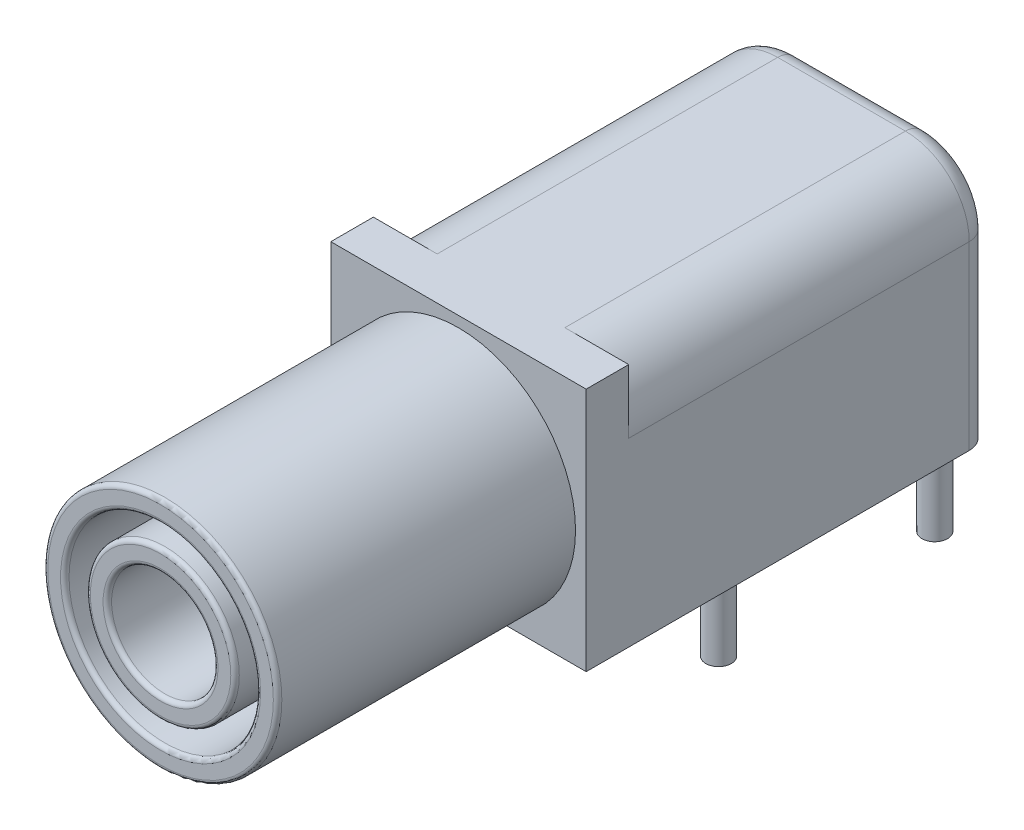
from build123d import *

# Parameters (mm, degrees)
SKETCH1_R             = 5.5
SKETCH1_R_2           = 4.5
BOSS_EXTRUDE1_DEPTH   = 14
SKETCH1_R_3           = 3.5
SKETCH1_R_4           = 2.5
BOSS_EXTRUDE1_2_DEPTH = 14
SKETCH1_3_W           = 12
SKETCH1_3_H           = 11.5
BOSS_EXTRUDE2_DEPTH   = 19
FILLET1_R             = 0.2
CUT_EXTRUDE1_DEPTH    = 17
FILLET3_R             = 1
SKETCH3_R             = 1.1
SKETCH3_R_2           = 0.6
BOSS_EXTRUDE3_DEPTH   = 3.4


with BuildPart() as part:
    # Sketch1 → Boss-Extrude1 (new body)
    with BuildSketch(Plane.XY):
        Circle(SKETCH1_R)
        Circle(SKETCH1_R_2, mode=Mode.SUBTRACT)
    extrude(amount=BOSS_EXTRUDE1_DEPTH)



with BuildPart() as body_2:
    # Sketch1 → Boss-Extrude1 2 (new body)
    with BuildSketch(Plane.XY):
        Circle(SKETCH1_R_3)
        Circle(SKETCH1_R_4, mode=Mode.SUBTRACT)
    extrude(amount=BOSS_EXTRUDE1_2_DEPTH)


with BuildPart() as part_1:
    add(part.part)

    add(body_2.part)  # Boss-Extrude2 merges body 2
    # Sketch1<3> → Boss-Extrude2 (add)
    with BuildSketch(Plane.XY):
        with Locations((0, 0.25)):
            Rectangle(SKETCH1_3_W, SKETCH1_3_H)
    extrude(amount=-BOSS_EXTRUDE2_DEPTH)

    # Fillet1
    fillet1_edges = [part_1.edges().sort_by_distance(p)[0] for p in [
        (-2.5, 0, 14),
        (-3.5, 0, 14),
        (-4.5, 0, 14),
        (-5.5, 0, 14),
    ]]
    fillet(fillet1_edges, radius=FILLET1_R)

    # Sketch2 → Cut-Extrude1 (cut)
    with BuildSketch(Plane(origin=(0, 0, -19), x_dir=(-1, 0, 0), z_dir=(0, 0, -1))):
        with BuildLine():
            Line((-8.747422549, 11), (-8.747422549, 1))
            Line((-8.747422549, 1), (-6, 1))
            Line((-6, 1), (-6, 3))
            ThreePointArc((-6, 3), (-5.121320344, 5.121320344), (-3, 6))
            Line((-3, 6), (3, 6))
            ThreePointArc((3, 6), (5.121320344, 5.121320344), (6, 3))
            Line((6, 3), (6, 1))
            Line((6, 1), (7.98389041, 1))
            Line((7.98389041, 1), (7.98389041, 11))
            Line((7.98389041, 11), (-8.747422549, 11))
        make_face()
    extrude(amount=-CUT_EXTRUDE1_DEPTH, mode=Mode.SUBTRACT)

    # Fillet3
    fillet3_edges = [part_1.edges().sort_by_distance(p)[0] for p in [
        (-6, -1.25, -19),
        (-5.121320344, 5.121320344, -19),
        (0, 6, -19),
        (5.121320344, 5.121320344, -19),
        (6, -1.25, -19),
    ]]
    fillet(fillet3_edges, radius=FILLET3_R)

    # Sketch3 → Boss-Extrude3 (add)
    with BuildSketch(Plane.XZ.offset(5.5)):
        with Locations((0, -13.5)):
            Circle(SKETCH3_R)
        with Locations((5.08, -17.3)):
            Circle(SKETCH3_R_2)
        with Locations((-5.08, -7.14)):
            Circle(SKETCH3_R_2)
        with Locations((-5.08, -17.3)):
            Circle(SKETCH3_R_2)
        with Locations((5.08, -7.14)):
            Circle(SKETCH3_R_2)
    extrude(amount=BOSS_EXTRUDE3_DEPTH)


solid = part_1.part
